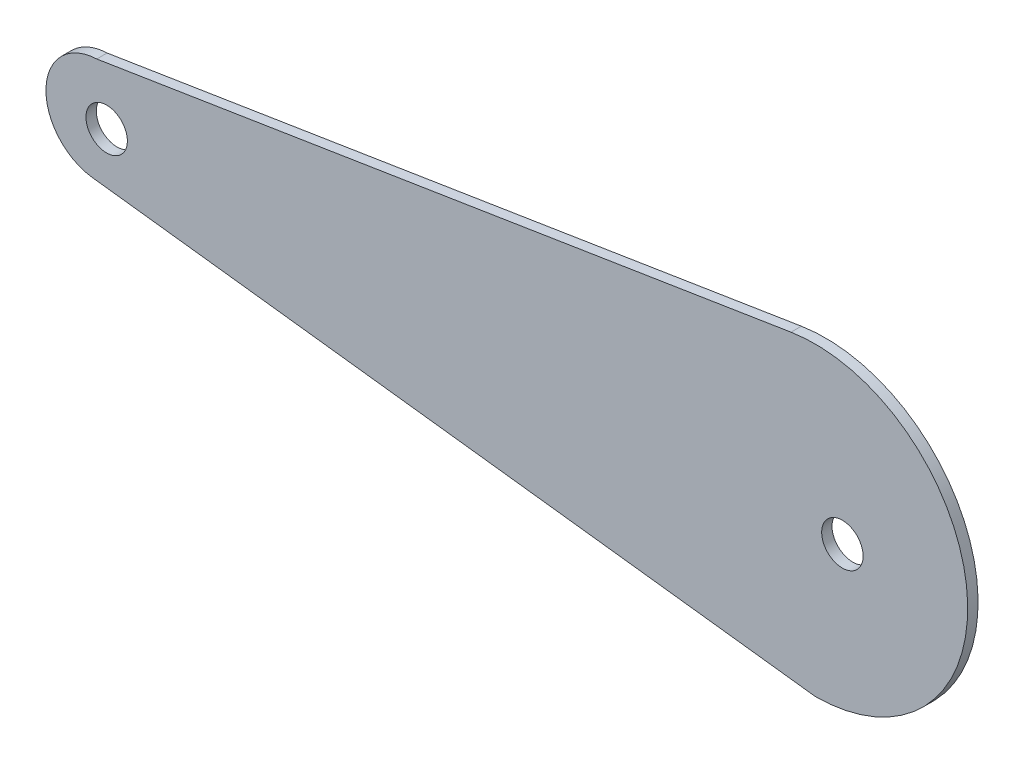
from build123d import *

# Parameters (mm, degrees)
BOSS_EXTRUDE1_DEPTH = 1
SKETCH2_R           = 2.000000064
CUT_EXTRUDE1_DEPTH  = 2.54
SCALE1_SCALE        = 1.3


with BuildPart() as part:
    # Sketch1 → Boss-Extrude1 (new body)
    with BuildSketch(Plane.XY):
        with BuildLine():
            Line((-69.316067153, 3.878962407), (-2.316488686, 14.547627491))
            ThreePointArc((-2.316488686, 14.547627491), (14.685052241, 1.161389736), (-0.000951264, -14.730905761))
            Line((-0.000951264, -14.730905761), (-69.753484787, -6.240756815))
            ThreePointArc((-69.753484787, -6.240756815), (-74.214947759, -0.978600121), (-69.316067153, 3.878962407))
        make_face()
    extrude(amount=BOSS_EXTRUDE1_DEPTH)

    # Sketch2 → Cut-Extrude1 (cut)
    with BuildSketch(Plane(origin=(0, 0, 0), x_dir=(-1, 0, 0), z_dir=(0, 0, -1))):
        with Locations((-2.636515213, -0.692372509)):
            Circle(SKETCH2_R)
        with Locations((68.361932579, -1.498185023)):
            Circle(SKETCH2_R)
    extrude(amount=-CUT_EXTRUDE1_DEPTH, mode=Mode.SUBTRACT)


with BuildPart() as part_1:
    # Scale1: scaled about (-22.971903001, -0.371312975, 0.5)
    add(part.part.scale(SCALE1_SCALE).moved(Location((6.8915709, 0.111393893, -0.15))))


solid = part_1.part
